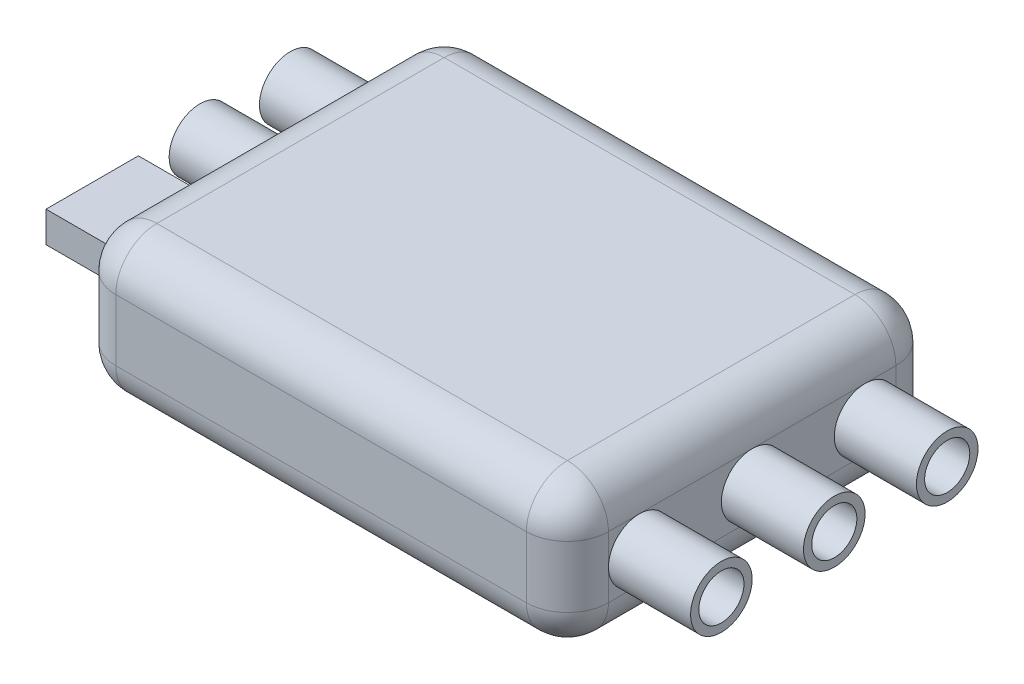
from build123d import *

# Parameters (mm, degrees)
BOSS_EXTRUDE1_DEPTH = 7
FILLET1_R           = 2
SKETCH3_R           = 1.5
SKETCH3_R_2         = 1.1
BOSS_EXTRUDE2_DEPTH = 4
BOSS_EXTRUDE3_START = 4
SKETCH4_R           = 1.5
SKETCH4_R_2         = 1.1
SKETCH4_W           = 4.5
SKETCH4_H           = 1.5
BOSS_EXTRUDE3_DEPTH = 4


with BuildPart() as part:
    # Sketch1 → Boss-Extrude1 (new body)
    with BuildSketch(Plane(origin=(0, 0, 0), x_dir=(1, 0, 0), z_dir=(0, 1, 0))):
        with BuildLine():
            Line((-10, 9), (10, 9))
            ThreePointArc((10, 9), (11.414213562, 8.414213562), (12, 7))
            Line((12, 7), (12, -7))
            ThreePointArc((12, -7), (11.414213562, -8.414213562), (10, -9))
            Line((10, -9), (-10, -9))
            ThreePointArc((-10, -9), (-11.414213562, -8.414213562), (-12, -7))
            Line((-12, -7), (-12, 7))
            ThreePointArc((-12, 7), (-11.414213562, 8.414213562), (-10, 9))
        make_face()
    extrude(amount=BOSS_EXTRUDE1_DEPTH)

    # Fillet1
    fillet1_edges = [part.edges().sort_by_distance(p)[0] for p in [
        (-11.414213562, 7, -8.414213562),
        (0, 0, -9),
        (11.414213562, 0, -8.414213562),
        (-12, 7, 0),
        (-11.414213562, 7, 8.414213562),
        (0, 7, 9),
        (11.414213562, 7, 8.414213562),
        (12, 7, 0),
        (11.414213562, 7, -8.414213562),
        (0, 7, -9),
        (12, 0, 0),
        (11.414213562, 0, 8.414213562),
        (0, 0, 9),
        (-11.414213562, 0, 8.414213562),
        (-12, 0, 0),
        (-11.414213562, 0, -8.414213562),
    ]]
    fillet(fillet1_edges, radius=FILLET1_R)

    # Sketch3 → Boss-Extrude2 (add)
    # profile 1 of 3: a face of its own
    with BuildSketch(Plane(origin=(12, 0, 0), x_dir=(0, 0, -1), z_dir=(1, 0, 0))):
        with Locations(Location((0, 3.5, 0), (0, 0, 270))):
            Circle(SKETCH3_R)
        with Locations((0, 3.5)):
            Circle(SKETCH3_R_2, mode=Mode.SUBTRACT)
    # profile 2 of 3: a face of its own
    with BuildSketch(Plane(origin=(12, 0, 0), x_dir=(0, 0, -1), z_dir=(1, 0, 0))):
        with Locations((5.5, 3.5)):
            Circle(SKETCH3_R)
        with Locations((5.5, 3.5)):
            Circle(SKETCH3_R_2, mode=Mode.SUBTRACT)
    # profile 3 of 3: a face of its own
    with BuildSketch(Plane(origin=(12, 0, 0), x_dir=(0, 0, -1), z_dir=(1, 0, 0))):
        with Locations(Location((-5.5, 3.5, 0), (0, 0, 180))):
            Circle(SKETCH3_R)
        with Locations((-5.5, 3.5)):
            Circle(SKETCH3_R_2, mode=Mode.SUBTRACT)
    extrude(amount=BOSS_EXTRUDE2_DEPTH)

    # Sketch4 → Boss-Extrude3 (add)
    # profile 1 of 3: a face of its own
    with BuildSketch(Plane.ZY.offset(12).offset(BOSS_EXTRUDE3_START)):
        with Locations(Location((-5.5, 3.5, 0), (0, 0, 180))):
            Circle(SKETCH4_R)
        with Locations(Location((-5.5, 3.5, 0), (0, 0, 180))):
            Circle(SKETCH4_R_2, mode=Mode.SUBTRACT)
    # profile 2 of 3: a face of its own
    with BuildSketch(Plane.ZY.offset(12).offset(BOSS_EXTRUDE3_START)):
        with Locations(Location((-1.1, 3.5, 0), (0, 0, 270))):
            Circle(SKETCH4_R)
        with Locations((-1.1, 3.5)):
            Circle(SKETCH4_R_2, mode=Mode.SUBTRACT)
    # profile 3 of 3: a face of its own
    with BuildSketch(Plane.ZY.offset(12).offset(BOSS_EXTRUDE3_START)):
        with Locations((4.147987763, 3.552994823)):
            Rectangle(SKETCH4_W, SKETCH4_H)
    extrude(amount=-BOSS_EXTRUDE3_DEPTH)


solid = part.part
